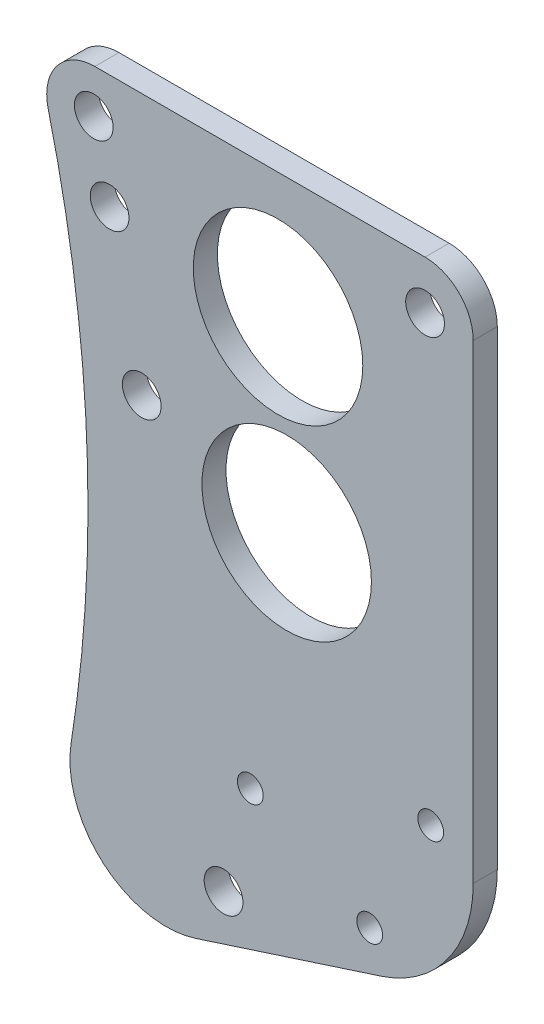
from build123d import *

# Parameters (mm, degrees)
SKETCH2_R           = 2.5527
SKETCH2_R_2         = 11.176
SKETCH2_R_3         = 1.7
BOSS_EXTRUDE1_DEPTH = 3.175


with BuildPart() as part:
    # Sketch2 → Boss-Extrude1 (new body)
    with BuildSketch(Plane.XY):
        with BuildLine():
            Line((89.804840449, 162.158224077), (133.35, 162.158224077))
            ThreePointArc((133.35, 162.158224077), (137.840128061, 160.298352138), (139.7, 155.808224077))
            Line((139.7, 155.808224077), (139.7, 93.800599977))
            ThreePointArc((139.7, 93.800599977), (136.352183067, 83.506635024), (127.589632634, 77.151219806))
            Line((127.589632634, 77.151219806), (103.12742621, 69.232468195))
            ThreePointArc((103.12742621, 69.232468195), (90.956620775, 71.66782369), (86.675019958, 83.318032089))
            ThreePointArc((86.675019958, 83.318032089), (88.737860448, 118.949701892), (83.642604572, 154.275465457))
            ThreePointArc((83.642604572, 154.275465457), (84.802065357, 159.719073266), (89.804840449, 162.158224077))
        make_face()
        with Locations((89.657841737, 156.395094021)):
            Circle(SKETCH2_R, mode=Mode.SUBTRACT)
        with Locations((91.747700228, 147.102187237)):
            Circle(SKETCH2_R, mode=Mode.SUBTRACT)
        with Locations((106.775437357, 76.433708644)):
            Circle(SKETCH2_R, mode=Mode.SUBTRACT)
        with Locations((115.1001, 121.545060726)):
            Circle(SKETCH2_R_2, mode=Mode.SUBTRACT)
        with Locations((113.962375762, 145.648224077)):
            Circle(SKETCH2_R_2, mode=Mode.SUBTRACT)
        with Locations((133.35, 155.808224077)):
            Circle(SKETCH2_R, mode=Mode.SUBTRACT)
        with Locations((95.988414932, 127.701170501)):
            Circle(SKETCH2_R, mode=Mode.SUBTRACT)
        with Locations((134.09377421, 97.646134406)):
            Circle(SKETCH2_R_3, mode=Mode.SUBTRACT)
        with Locations((126.045534429, 81.906825767)):
            Circle(SKETCH2_R_3, mode=Mode.SUBTRACT)
        with Locations((110.30622579, 89.955065547)):
            Circle(SKETCH2_R_3, mode=Mode.SUBTRACT)
    extrude(amount=BOSS_EXTRUDE1_DEPTH)


solid = part.part
